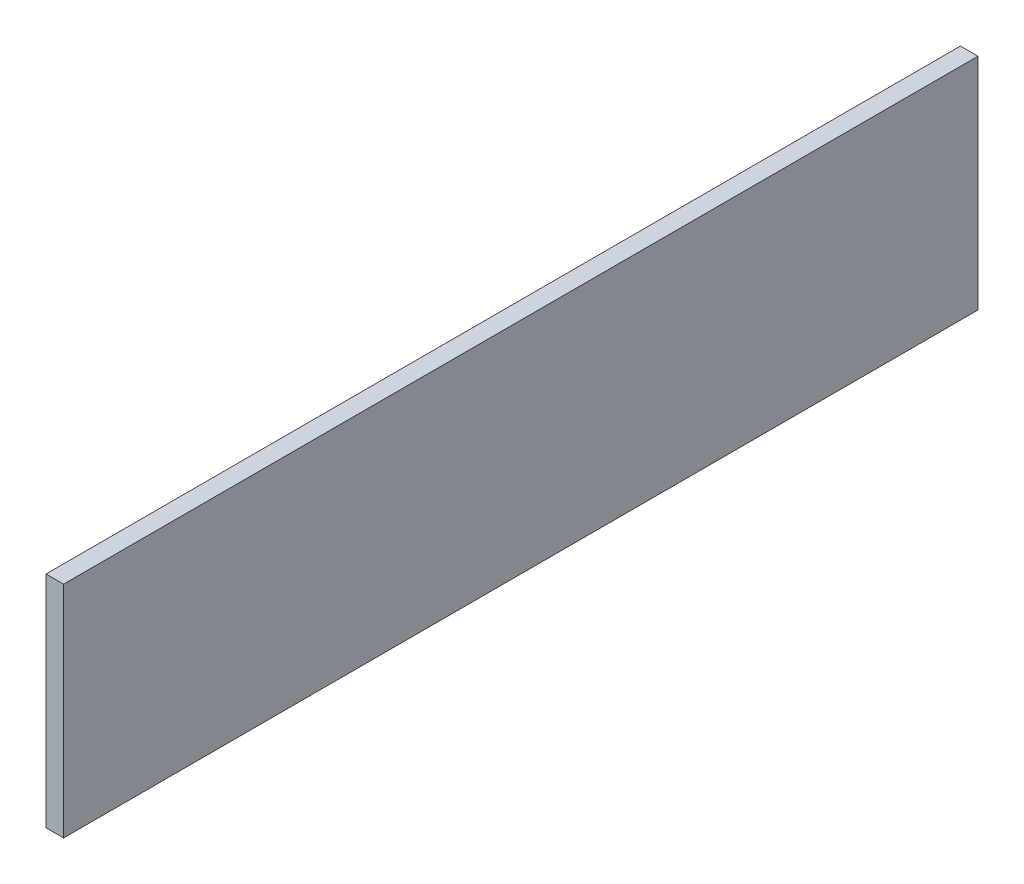
from build123d import *

# Parameters (mm, degrees)
SKETCH2_W           = 160
SKETCH2_H           = 8320
BOSS_EXTRUDE1_DEPTH = 2000


with BuildPart() as part:
    # Sketch2 → Boss-Extrude1 (new body)
    with BuildSketch(Plane(origin=(0, 0, 0), x_dir=(1, 0, 0), z_dir=(0, 1, 0))):
        Rectangle(SKETCH2_W, SKETCH2_H)
    extrude(amount=BOSS_EXTRUDE1_DEPTH)


solid = part.part
